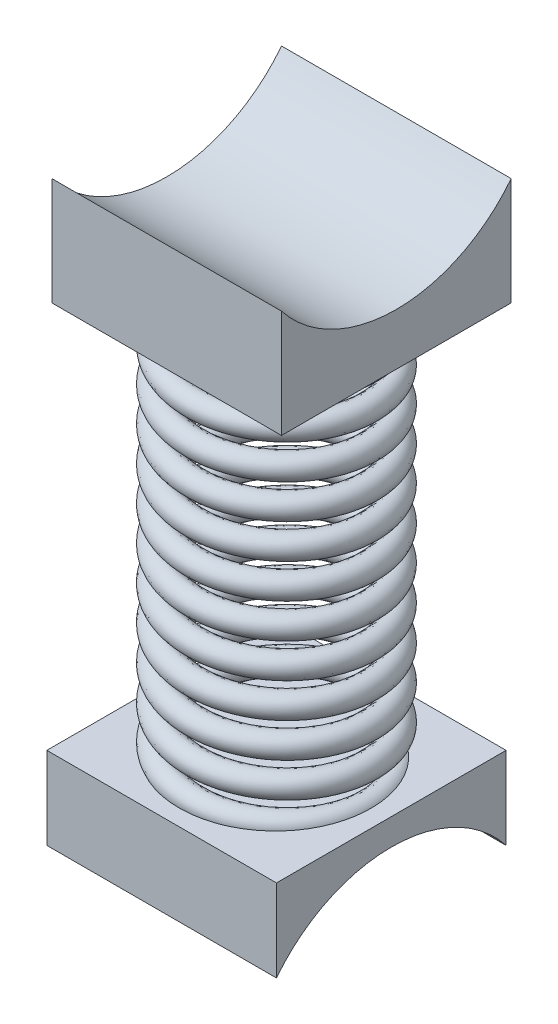
from build123d import *

# Parameters (mm, degrees)
SWEEP1_PITCH        = 3
SWEEP1_HEIGHT       = 45
SWEEP1_RADIUS       = 7.62
SWEEP1_START_ANGLE  = -90
SWEEP1_PROFILE_R    = 1
SKETCH10_W          = 20
SKETCH10_H          = 20
BOSS_EXTRUDE1_DEPTH = 5
BOSS_EXTRUDE2_DEPTH = 5
SKETCH11_R          = 12.7
SKETCH11_R_2        = 1.27
CUT_EXTRUDE1_DEPTH  = 20
SKETCH12_R          = 12.7
CUT_EXTRUDE2_DEPTH  = 20


with BuildPart() as part:
    # Sweep1: sweep along a helix
    with BuildLine() as sweep1_path:
        add(Helix(SWEEP1_PITCH, SWEEP1_HEIGHT, SWEEP1_RADIUS, center=(0, 0, 0), direction=(0, 1, 0), lefthand=True, mode=Mode.PRIVATE).rotate(Axis((0, 0, 0), (0, 1, 0)), SWEEP1_START_ANGLE))
    # Sweep1 profile (on start of the path) → Sweep1 (sweep)
    with BuildSketch(Plane(origin=(-7.62, 0, 0), x_dir=(0, -0.998042659945487, -0.06253678060899105), z_dir=(-2.0109474499162646e-13, 0.06253678060899105, -0.998042659945487))):
        Circle(SWEEP1_PROFILE_R)
    sweep(path=sweep1_path.line, is_frenet=True)

    # Sketch10 → Boss-Extrude1 (add, symmetric)
    with BuildSketch(Plane(origin=(0, 0, 0), x_dir=(1, 0, 0), z_dir=(0, 1, 0))):
        Rectangle(SKETCH10_W, SKETCH10_H)
    extrude(amount=BOSS_EXTRUDE1_DEPTH, both=True)

    # 3DSketch2 → Boss-Extrude2 (add, symmetric)
    with BuildSketch(Plane(origin=(-9.558432472, 43.967656484, -10), x_dir=(0.7071067811865478, 0, 0.7071067811865474), z_dir=(0, -1, 0))):
        Polygon((0, 0), (14.142135624, -14.142135624), (28.284271247, 0), (14.142135624, 14.142135624), align=None)
    extrude(amount=BOSS_EXTRUDE2_DEPTH, both=True)

    # Sketch11 → Cut-Extrude1 (cut)
    with BuildSketch(Plane(origin=(10, 0, 0), x_dir=(0, 0, -1), z_dir=(1, 0, 0))):
        with Locations((0, -10)):
            Circle(SKETCH11_R)
        with Locations((0, -10)):
            Circle(SKETCH11_R_2, mode=Mode.SUBTRACT)
    extrude(amount=-CUT_EXTRUDE1_DEPTH, mode=Mode.SUBTRACT)

    # Sketch12 → Cut-Extrude2 (cut)
    with BuildSketch(Plane(origin=(10.441567528, 0, 0), x_dir=(0, 0, -1), z_dir=(1, 0, 0))):
        with Locations((0, 56.174925621)):
            Circle(SKETCH12_R)
    extrude(amount=-CUT_EXTRUDE2_DEPTH, mode=Mode.SUBTRACT)


solid = part.part
